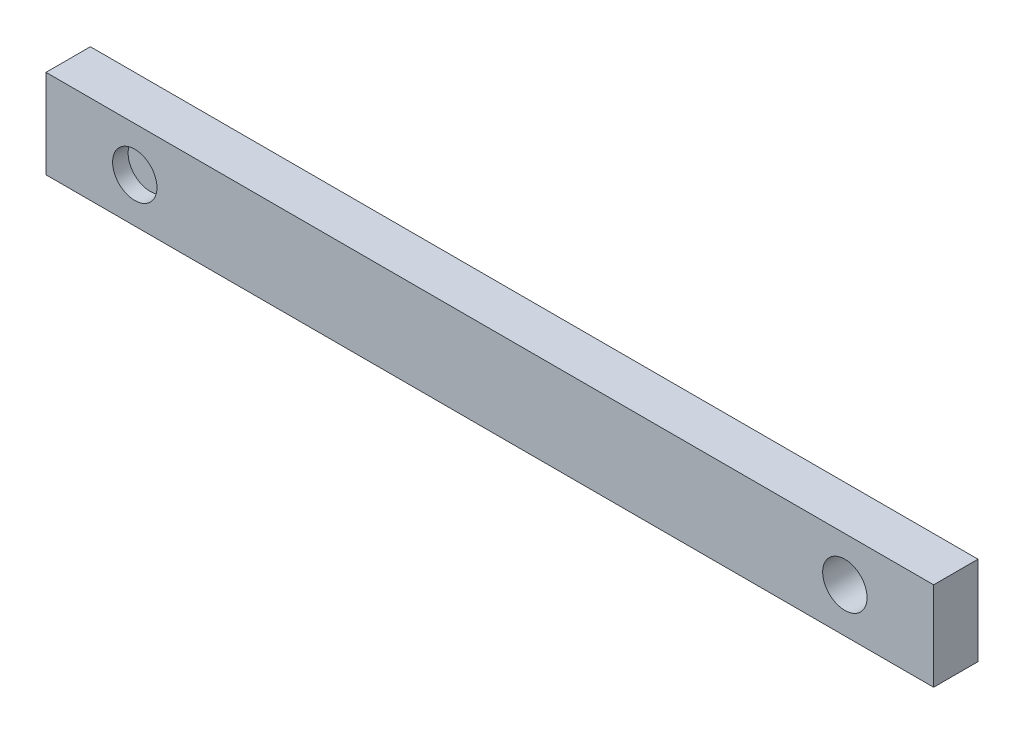
from build123d import *

# Parameters (mm, degrees)
SKETCH2_W           = 200
SKETCH2_H           = 20
SKETCH2_R           = 5
BOSS_EXTRUDE2_DEPTH = 10
SKETCH3_R           = 5
CUT_EXTRUDE1_DEPTH  = 3.5


with BuildPart() as part:
    # Sketch2 → Boss-Extrude2 (new body)
    with BuildSketch(Plane.XY):
        with Locations((2.164301209, 0)):
            Rectangle(SKETCH2_W, SKETCH2_H)
        with Locations((82.164301209, 0)):
            Circle(SKETCH2_R, mode=Mode.SUBTRACT)
    extrude(amount=BOSS_EXTRUDE2_DEPTH)

    # Sketch3 → Cut-Extrude1 (cut)
    with BuildSketch(Plane.XY.offset(10)):
        with Locations((-77.835698791, 0)):
            Circle(SKETCH3_R)
    extrude(amount=-CUT_EXTRUDE1_DEPTH, mode=Mode.SUBTRACT)


solid = part.part
